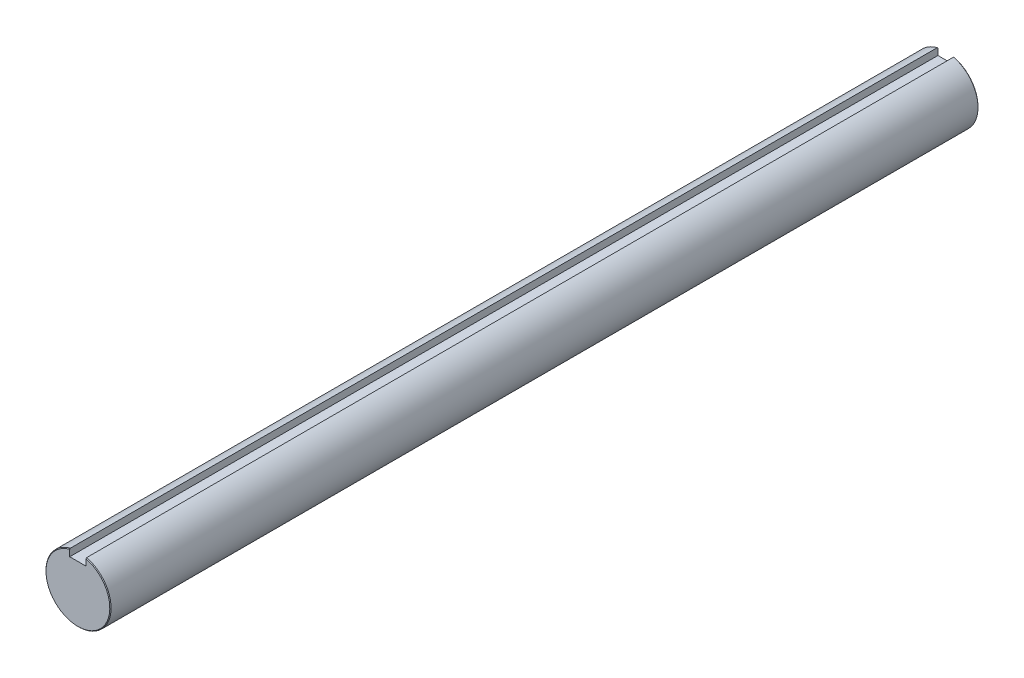
from build123d import *

# Parameters (mm, degrees)
BOSS_EXTRUDE1_DEPTH      = 127
BOSS_EXTRUDE1_DEPTH_BACK = 127
CHAMFER1_SIZE            = 0.1905


with BuildPart() as part:
    # Sketch3 → Boss-Extrude1 (new, two sides: drawn at the far end of the back side and taken through both)
    with BuildSketch(Plane.XY.offset(-BOSS_EXTRUDE1_DEPTH_BACK)):
        with BuildLine():
            Line((-2.3876, 7.1374), (-2.3876, 9.220899698))
            ThreePointArc((-2.3876, 9.220899698), (0, -9.525), (2.3876, 9.220899698))
            Line((2.3876, 9.220899698), (2.3876, 7.1374))
            Line((2.3876, 7.1374), (-2.3876, 7.1374))
        make_face()
    extrude(amount=BOSS_EXTRUDE1_DEPTH + BOSS_EXTRUDE1_DEPTH_BACK)

    # Chamfer1
    chamfer1_edges = [part.edges().sort_by_distance(p)[0] for p in [
        (0, -9.525, -127),
        (0, -9.525, 127),
    ]]
    chamfer(chamfer1_edges, length=CHAMFER1_SIZE)


solid = part.part
